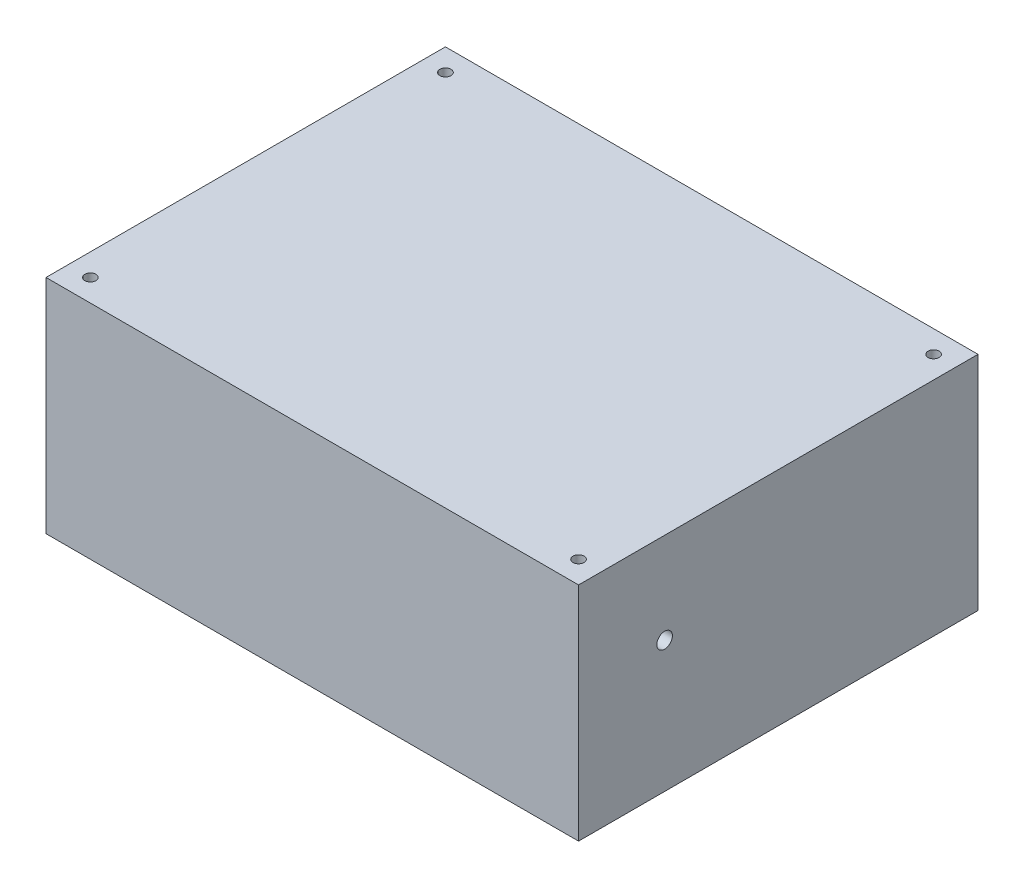
from build123d import *

# Parameters (mm, degrees)
SKETCH1_W             = 120
SKETCH1_H             = 90
BOSS_EXTRUDE1_DEPTH   = 50
M3_TAPPED_HOLE1_D     = 2.5
M3_TAPPED_HOLE1_DEPTH = 50
M3_TAPPED_HOLE1_TIP   = 0.751075774
SHELL2_T              = -2.5
FILLET2_R             = 2
CUT_EXTRUDE2_REACH    = 139.568
SKETCH13_R            = 5
CUT_EXTRUDE3_REACH    = 139.568
SKETCH14_R            = 1.75
SKETCH15_R            = 2
BOSS_EXTRUDE2_DEPTH   = 10
SKETCH16_R            = 1.5
CUT_EXTRUDE4_DEPTH    = 5


with BuildPart() as part:
    # Sketch1 → Boss-Extrude1 (new body)
    with BuildSketch(Plane(origin=(0, 0, 0), x_dir=(1, 0, 0), z_dir=(0, 1, 0))):
        Rectangle(SKETCH1_W, SKETCH1_H)
    extrude(amount=BOSS_EXTRUDE1_DEPTH)

    # M3 Tapped Hole1
    with Locations(Plane(origin=(0, 0, 0), x_dir=(-1, 0, 0), z_dir=(0, -1, 0))):
        with Locations((55, -40), (55, 40), (-55, 40), (-55, -40)):
            Hole(M3_TAPPED_HOLE1_D / 2, depth=M3_TAPPED_HOLE1_DEPTH)
            with Locations((0, 0, -(M3_TAPPED_HOLE1_DEPTH + M3_TAPPED_HOLE1_TIP / 2))):  # 118° drill point
                Cone(0, M3_TAPPED_HOLE1_D / 2, M3_TAPPED_HOLE1_TIP, mode=Mode.SUBTRACT)

    # Shell2
    shell2_openings = [part.faces().sort_by_distance(p)[0] for p in [
        (0, 0, 0),
    ]]
    offset(amount=SHELL2_T, openings=shell2_openings, kind=Kind.INTERSECTION)

    # Fillet2
    fillet2_edges = [part.edges().sort_by_distance(p)[0] for p in [
        (-52.204915028, 23.75, 42.5),
        (-57.5, 23.75, -37.204915028),
        (-52.204915028, 23.75, -42.5),
        (52.204915028, 23.75, -42.5),
        (57.5, 23.75, -37.204915028),
        (57.5, 23.75, 37.204915028),
        (52.204915028, 23.75, 42.5),
        (-57.5, 23.75, 37.204915028),
    ]]
    fillet(fillet2_edges, radius=FILLET2_R)

    # Sketch13 → Cut-Extrude2 (cut, up to next)
    with BuildSketch(Plane.ZY.offset(60), mode=Mode.PRIVATE) as cut_extrude2_sk1:
        with Locations((-19.268421651, 23.803658595)):
            Circle(SKETCH13_R)
    cut_extrude2_tool1 = extrude(cut_extrude2_sk1.sketch, amount=-CUT_EXTRUDE2_REACH, mode=Mode.PRIVATE) & part.part
    add(cut_extrude2_tool1.solids().sort_by_distance((-60, 23.803659, -19.268422))[0], mode=Mode.SUBTRACT)

    # Sketch14 → Cut-Extrude3 (cut, up to next)
    with BuildSketch(Plane(origin=(60, 0, 0), x_dir=(0, 0, -1), z_dir=(1, 0, 0)), mode=Mode.PRIVATE) as cut_extrude3_sk1:
        with Locations((-25.609467242, 29.516078094)):
            Circle(SKETCH14_R)
    cut_extrude3_tool1 = extrude(cut_extrude3_sk1.sketch, amount=-CUT_EXTRUDE3_REACH, mode=Mode.PRIVATE) & part.part
    add(cut_extrude3_tool1.solids().sort_by_distance((60, 29.516078, 25.609467))[0], mode=Mode.SUBTRACT)

    # Sketch15 → Boss-Extrude2 (add)
    with BuildSketch(Plane.XZ.offset(-47.5)):
        with Locations((-42.5, -27.5)):
            Circle(SKETCH15_R)
        with Locations((-42.5, 21)):
            Circle(SKETCH15_R)
        with Locations((19.9, -27.5)):
            Circle(SKETCH15_R)
        with Locations((19.9, 21)):
            Circle(SKETCH15_R)
    extrude(amount=BOSS_EXTRUDE2_DEPTH)

    # Sketch16 → Cut-Extrude4 (cut)
    with BuildSketch(Plane.XZ.offset(-37.5)):
        with Locations((-42.5, 21)):
            Circle(SKETCH16_R)
        with Locations((19.9, 21)):
            Circle(SKETCH16_R)
        with Locations((-42.5, -27.5)):
            Circle(SKETCH16_R)
        with Locations((19.9, -27.5)):
            Circle(SKETCH16_R)
    extrude(amount=-CUT_EXTRUDE4_DEPTH, mode=Mode.SUBTRACT)


solid = part.part
